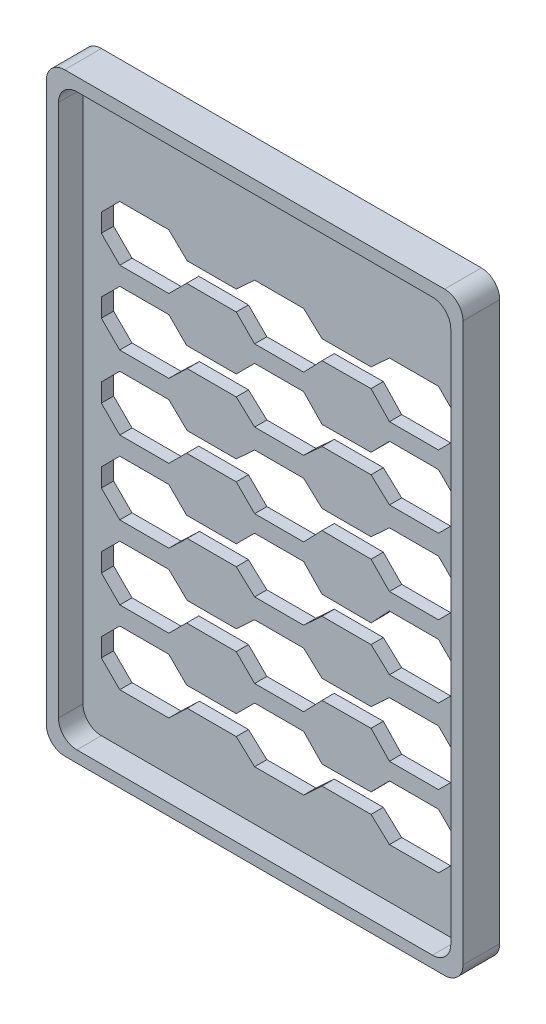
from build123d import *

# Parameters (mm, degrees)
BOSS_EXTRUDE1_DEPTH = 6
BOSS_EXTRUDE2_DEPTH = 2


with BuildPart() as part:
    # Sketch1 → Boss-Extrude1 (new body)
    with BuildSketch(Plane(origin=(0, 0, 0), x_dir=(0, 1, 0), z_dir=(0, 0, 1))):
        with BuildLine():
            Line((-45.5, -34), (45.5, -34))
            ThreePointArc((45.5, -34), (47.621320344, -33.121320344), (48.5, -31))
            Line((48.5, -31), (48.5, 31))
            ThreePointArc((48.5, 31), (47.621320344, 33.121320344), (45.5, 34))
            Line((45.5, 34), (-45.5, 34))
            ThreePointArc((-45.5, 34), (-47.621320344, 33.121320344), (-48.5, 31))
            Line((-48.5, 31), (-48.5, -31))
            ThreePointArc((-48.5, -31), (-47.621320344, -33.121320344), (-45.5, -34))
        make_face()
        with BuildLine():
            Line((46.382784344, 29.008682641), (46.382784344, -29.008682641))
            ThreePointArc((46.382784344, -29.008682641), (45.504104688, -31.130002985), (43.382784344, -32.008682641))
            Line((43.382784344, -32.008682641), (-43.617215656, -32.008682641))
            ThreePointArc((-43.617215656, -32.008682641), (-45.738535999, -31.130002985), (-46.617215656, -29.008682641))
            Line((-46.617215656, -29.008682641), (-46.617215656, 29.008682641))
            ThreePointArc((-46.617215656, 29.008682641), (-45.738535999, 31.130002985), (-43.617215656, 32.008682641))
            Line((-43.617215656, 32.008682641), (43.382784344, 32.008682641))
            ThreePointArc((43.382784344, 32.008682641), (45.504104688, 31.130002985), (46.382784344, 29.008682641))
        make_face(mode=Mode.SUBTRACT)
    extrude(amount=BOSS_EXTRUDE1_DEPTH)

    # Sketch1<3> → Boss-Extrude2 (add)
    with BuildSketch(Plane(origin=(0, 0, 0), x_dir=(0, 1, 0), z_dir=(0, 0, 1))):
        with BuildLine():
            ThreePointArc((43.382784344, -32.008682641), (45.504104688, -31.130002985), (46.382784344, -29.008682641))
            Line((46.382784344, -29.008682641), (46.382784344, 29.008682641))
            ThreePointArc((46.382784344, 29.008682641), (45.504104688, 31.130002985), (43.382784344, 32.008682641))
            Line((43.382784344, 32.008682641), (-43.617215656, 32.008682641))
            ThreePointArc((-43.617215656, 32.008682641), (-45.738535999, 31.130002985), (-46.617215656, 29.008682641))
            Line((-46.617215656, 29.008682641), (-46.617215656, -29.008682641))
            ThreePointArc((-46.617215656, -29.008682641), (-45.738535999, -31.130002985), (-43.617215656, -32.008682641))
            Line((-43.617215656, -32.008682641), (43.382784344, -32.008682641))
        make_face()
        Polygon((-38.617215656, 18.008682641), (-38.617215656, 26.008682641), (-35.617215656, 29.008682641), (-32.617215656, 29.008682641), (-29.608533015, 26), (-29.608533015, 18), (-32.5, 15.108533015), (-32.5, 7), (-29.5, 4), (-29.5, -4), (-32.617231433, -6.999999928), (-32.564041089, -14.9998231), (-29.5, -18), (-29.5, -26), (-32.5, -29), (-35.5, -29), (-38.5, -26), (-38.5, -18), (-35.734431311, -15), (-35.734431311, -7), (-38.5, -4), (-38.5, 4), (-35.734431311, 7), (-35.734431311, 15), align=None, mode=Mode.SUBTRACT)
        Polygon((-17.734431311, -26), (-20.734431311, -29), (-23.734431311, -29), (-26.734431311, -26), (-26.734431311, -18), (-23.564091544, -14.998869032), (-23.617199878, -6.999999928), (-26.734431311, -4), (-26.734431311, 4), (-23.734431311, 7), (-23.734431311, 15.108533015), (-26.625898297, 18), (-26.625898297, 26), (-23.617215656, 29.008682641), (-20.617215656, 29.008682641), (-17.617215656, 26.008682641), (-17.617215656, 18.008682641), (-20.5, 15), (-20.5, 7), (-17.734431311, 4), (-17.734431311, -4), (-20.5, -7), (-20.5, -15), (-17.734431311, -18), align=None, mode=Mode.SUBTRACT)
        Polygon((-5.5, -4), (-8.617231433, -6.999999928), (-8.670339768, -14.998869032), (-5.5, -18), (-5.5, -26), (-8.5, -29), (-11.5, -29), (-14.5, -26), (-14.5, -18), (-11.734431311, -15), (-11.734431311, -7), (-14.5, -4), (-14.5, 4), (-11.734431311, 7), (-11.734431311, 15), (-14.617215656, 18.008682641), (-14.617215656, 26.008682641), (-11.617215656, 29.008682641), (-8.617215656, 29.008682641), (-5.608533015, 26), (-5.608533015, 18), (-8.5, 15.108533015), (-8.5, 7), (-5.5, 4), align=None, mode=Mode.SUBTRACT)
        Polygon((3.265568689, -29), (0.265568689, -29), (-2.734431311, -26), (-2.734431311, -18), (0.329609777, -14.9998231), (0.382800122, -6.999999928), (-2.734431311, -4), (-2.734431311, 4), (0.265568689, 7), (0.265568689, 15.108533015), (-2.625898297, 18), (-2.625898297, 26), (0.382784344, 29.008682641), (3.382784344, 29.008682641), (6.382784344, 26.008682641), (6.382784344, 18.008682641), (3.5, 15), (3.5, 7), (6.265568689, 4), (6.265568689, -4), (3.5, -7), (3.5, -15), (6.265568689, -18), (6.265568689, -26), align=None, mode=Mode.SUBTRACT)
        Polygon((15.5, -29), (12.5, -29), (9.5, -26), (9.5, -18), (12.265568689, -15), (12.265568689, -7), (9.5, -4), (9.5, 4), (12.265568689, 7), (12.265568689, 15), (9.382784344, 18.008682641), (9.382784344, 26.008682641), (12.382784344, 29.008682641), (15.382784344, 29.008682641), (18.391466985, 26), (18.391466985, 18), (15.5, 15.108533015), (15.5, 7), (18.5, 4), (18.5, -4), (15.382768567, -6.999999928), (15.435958911, -14.9998231), (18.5, -18), (18.5, -26), align=None, mode=Mode.SUBTRACT)
        Polygon((30.265568689, -26), (27.265568689, -29), (24.265568689, -29), (21.265568689, -26), (21.265568689, -18), (24.435908456, -14.998869032), (24.382800122, -6.999999928), (21.265568689, -4), (21.265568689, 4), (24.265568689, 7), (24.265568689, 15.108533015), (21.374101703, 18), (21.374101703, 26), (24.382784344, 29.008682641), (27.382784344, 29.008682641), (30.382784344, 26.008682641), (30.382784344, 18.008682641), (27.5, 15), (27.5, 7), (30.265568689, 4), (30.265568689, -4), (27.5, -7), (27.5, -15), (30.265568689, -18), align=None, mode=Mode.SUBTRACT)
    extrude(amount=BOSS_EXTRUDE2_DEPTH)


solid = part.part
